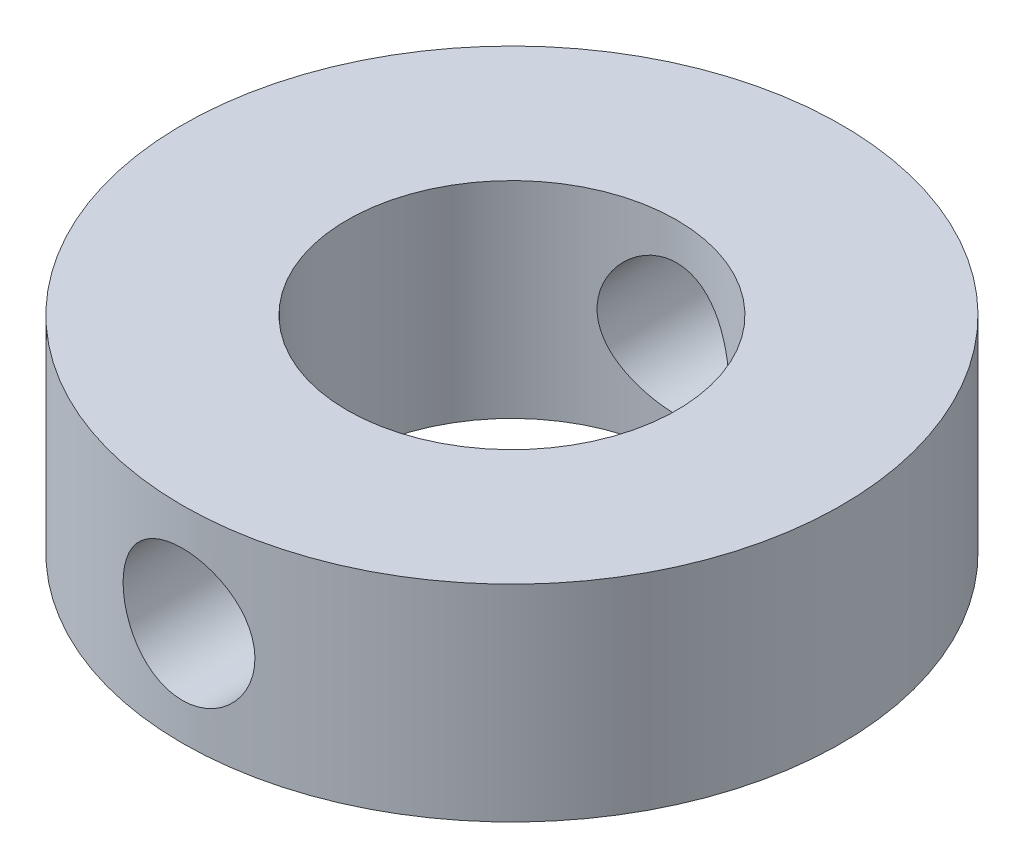
from build123d import *

# Parameters (mm, degrees)
ESQUISSE1_R                  = 8
ESQUISSE1_R_2                = 4
BOSS_EXTRU_1_DEPTH           = 2.5
BOSS_EXTRU_2_START           = -2.5
ESQUISSE1_2_R                = 8
ESQUISSE1_2_R_2              = 4
BOSS_EXTRU_2_DEPTH           = 2.5
ENL_V_MAT_EXTRU_1_DEPTH      = 50
ENL_V_MAT_EXTRU_1_DEPTH_BACK = 50
ESQUISSE2_R                  = 1.6


with BuildPart() as part:
    # Esquisse1 → Boss.-Extru.1 (new body)
    with BuildSketch(Plane(origin=(0, 0, 0), x_dir=(1, 0, 0), z_dir=(0, 1, 0))):
        Circle(ESQUISSE1_R)
        Circle(ESQUISSE1_R_2, mode=Mode.SUBTRACT)
    extrude(amount=BOSS_EXTRU_1_DEPTH)

    # Esquisse1<2> → Boss.-Extru.2 (add)
    with BuildSketch(Plane(origin=(0, 0, 0), x_dir=(1, 0, 0), z_dir=(0, 1, 0)).offset(BOSS_EXTRU_2_START)):
        Circle(ESQUISSE1_2_R)
        Circle(ESQUISSE1_2_R_2, mode=Mode.SUBTRACT)
    extrude(amount=BOSS_EXTRU_2_DEPTH)

    # Esquisse2 → Enlèv. mat.-Extru.1 (cut, two sides: drawn at the far end of the back side and taken through both)
    with BuildSketch(Plane.XY.offset(-ENL_V_MAT_EXTRU_1_DEPTH_BACK)):
        Circle(ESQUISSE2_R)
    extrude(amount=ENL_V_MAT_EXTRU_1_DEPTH + ENL_V_MAT_EXTRU_1_DEPTH_BACK, mode=Mode.SUBTRACT)


solid = part.part
